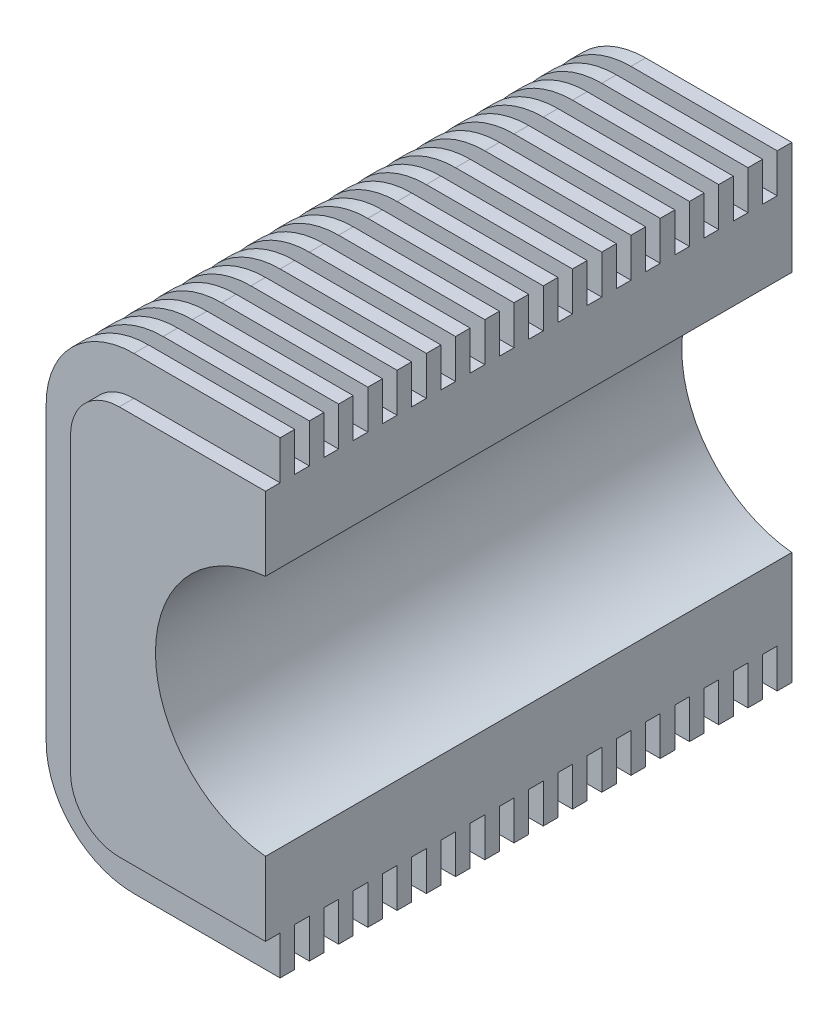
from build123d import *

# Parameters (mm, degrees)
DODANIE_WYCI_GNI_CIE1_DEPTH = 108
SZKIC2_R                    = 25
WYTNIJ_WYCI_GNI_CIE1_DEPTH  = 138.437258413
DODANIE_WYCI_GNI_CIE2_DEPTH = 3
SZYK_LINIOWY1_COUNT         = 18
SZYK_LINIOWY1_PITCH         = 6


with BuildPart() as part:
    # Szkic1 → Dodanie-wyciągnięcie1 (new body)
    with BuildSketch(Plane.XY):
        with BuildLine():
            Line((0, 75), (-30, 75))
            ThreePointArc((-30, 75), (-37.071067812, 72.071067812), (-40, 65))
            Line((-40, 65), (-40, 5))
            ThreePointArc((-40, 5), (-37.071067812, -2.071067812), (-30, -5))
            Line((-30, -5), (0, -5))
            Line((0, -5), (0, 75))
        make_face()
    extrude(amount=DODANIE_WYCI_GNI_CIE1_DEPTH)

    # Szkic2 → Wytnij-wyciągnięcie1 (cut, through all)
    with BuildSketch(Plane.XY.offset(108)):
        with Locations((2.42237831, 35)):
            Circle(SZKIC2_R)
    extrude(amount=-WYTNIJ_WYCI_GNI_CIE1_DEPTH, mode=Mode.SUBTRACT)

    # Szkic3 → Dodanie-wyciągnięcie2 (add)
    with BuildSketch(Plane(origin=(0, 0, 0), x_dir=(-1, 0, 0), z_dir=(0, 0, -1))):
        with BuildLine():
            Line((48, 5), (48, 65))
            ThreePointArc((48, 65), (42.727922061, 77.727922061), (30, 83))
            Line((30, 83), (0, 83))
            Line((0, 83), (0, 75))
            Line((0, 75), (30, 75))
            ThreePointArc((30, 75), (37.071067812, 72.071067812), (40, 65))
            Line((40, 65), (40, 5))
            ThreePointArc((40, 5), (37.071067812, -2.071067812), (30, -5))
            Line((30, -5), (0, -5))
            Line((0, -5), (0, -13))
            Line((0, -13), (30, -13))
            ThreePointArc((30, -13), (42.727922061, -7.727922061), (48, 5))
        make_face()
    dodanie_wyci_gni_cie2 = extrude(amount=-DODANIE_WYCI_GNI_CIE2_DEPTH)

    # Szyk liniowy1: Dodanie-wyciągnięcie2 ×18
    with Locations(*[(0, 0, i * SZYK_LINIOWY1_PITCH) for i in range(1, SZYK_LINIOWY1_COUNT)]):
        add(dodanie_wyci_gni_cie2)


solid = part.part
